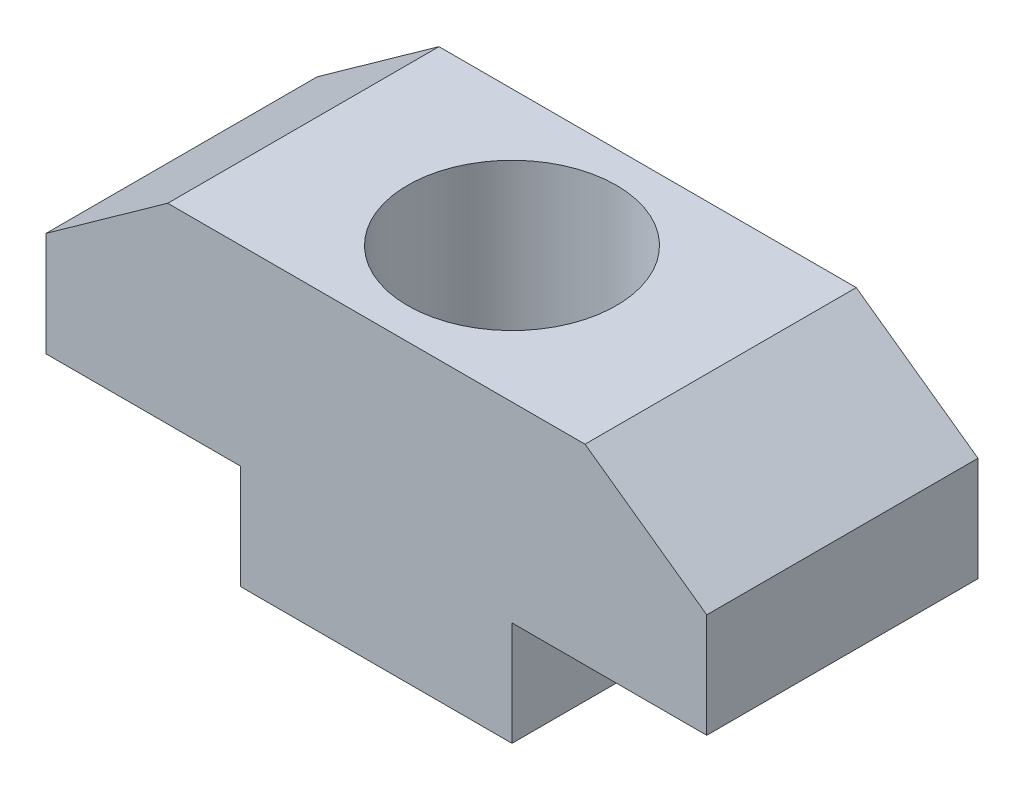
from build123d import *

# Parameters (mm, degrees)
EXTRUDE_2_DEPTH     = 7.8
SKETCH_3_W          = 7.8
SKETCH_3_H          = 7.8
EXTRUDE_3_DEPTH     = 3
CUT_EXTRUDE_1_REACH = 24.228
SKETCH_4_R          = 3


with BuildPart() as part:
    # 草图2 → 凸台-拉伸2 (new body)
    with BuildSketch(Plane.XY):
        Polygon((0, 0), (19, 0), (19, 3), (15.5, 5.5), (3.5, 5.5), (0, 3), align=None)
    extrude(amount=EXTRUDE_2_DEPTH)

    # 草图3 → 凸台-拉伸3 (add)
    with BuildSketch(Plane(origin=(0, 0, 0), x_dir=(-1, 0, 0), z_dir=(0, -1, 0))):
        with Locations((-9.5, -3.9)):
            Rectangle(SKETCH_3_W, SKETCH_3_H)
    extrude(amount=EXTRUDE_3_DEPTH)

    # 草图4 → 切除-拉伸1 (cut, up to next)
    with BuildSketch(Plane(origin=(0, -3, 0), x_dir=(-1, 0, 0), z_dir=(0, -1, 0)), mode=Mode.PRIVATE) as cut_extrude_1_sk1:
        with Locations(Location((-9.5, -3.9, 0), (0, 0, 90))):
            Circle(SKETCH_4_R)
    cut_extrude_1_tool1 = extrude(cut_extrude_1_sk1.sketch, amount=-CUT_EXTRUDE_1_REACH, mode=Mode.PRIVATE) & part.part
    add(cut_extrude_1_tool1.solids().sort_by_distance((9.5, -3, 3.9))[0], mode=Mode.SUBTRACT)


solid = part.part
